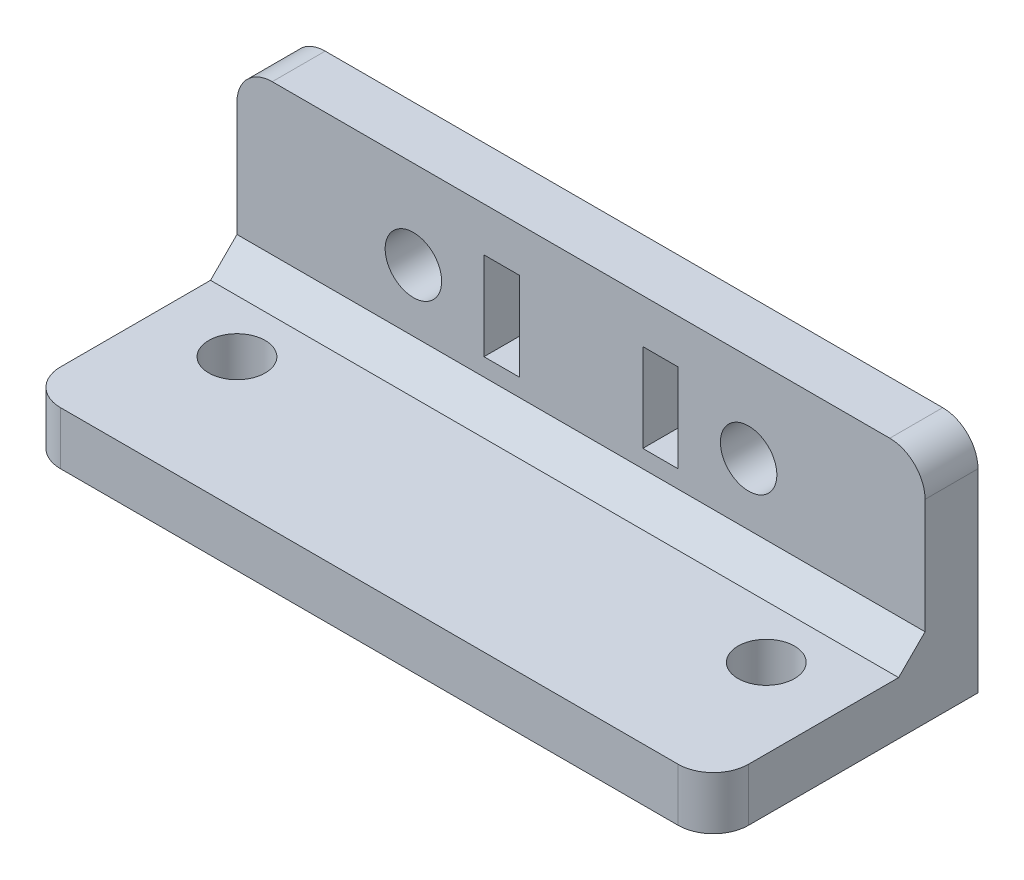
from build123d import *

# Parameters (mm, degrees)
SKETCH_1_W      = 39
SKETCH_1_H      = 10
SKETCH_1_R      = 1.6
SKETCH_1_W_2    = 2
SKETCH_1_H_2    = 5
EXTRUDE_1_DEPTH = 3
SKETCH_2_W      = 39
SKETCH_2_H      = 15
SKETCH_2_R      = 1.6
EXTRUDE_2_DEPTH = 3
CHAMFER_1_SIZE  = 1.5
FILLET_1_R      = 2


with BuildPart() as part:
    # ｽｹｯﾁ1 → ﾎﾞｽ - 押し出し1 (new body)
    with BuildSketch(Plane.XY):
        with Locations((9.5, 0)):
            Rectangle(SKETCH_1_W, SKETCH_1_H)
        Circle(SKETCH_1_R, mode=Mode.SUBTRACT)
        with Locations((19, 0)):
            Circle(SKETCH_1_R, mode=Mode.SUBTRACT)
        with Locations((5, 0)):
            Rectangle(SKETCH_1_W_2, SKETCH_1_H_2, mode=Mode.SUBTRACT)
        with Locations((14, 0)):
            Rectangle(SKETCH_1_W_2, SKETCH_1_H_2, mode=Mode.SUBTRACT)
    extrude(amount=EXTRUDE_1_DEPTH)

    # ｽｹｯﾁ2 → ﾎﾞｽ - 押し出し2 (add)
    with BuildSketch(Plane.XZ.offset(5)):
        with Locations((9.5, 7.5)):
            Rectangle(SKETCH_2_W, SKETCH_2_H)
        with Locations((-5.5, 7.5)):
            Circle(SKETCH_2_R, mode=Mode.SUBTRACT)
        with Locations((24.5, 7.5)):
            Circle(SKETCH_2_R, mode=Mode.SUBTRACT)
    extrude(amount=EXTRUDE_2_DEPTH)

    # 面取り1
    chamfer_1_edges = [part.edges().sort_by_distance(p)[0] for p in [
        (9.5, -5, 3),
    ]]
    chamfer(chamfer_1_edges, length=CHAMFER_1_SIZE)

    # ﾌｨﾚｯﾄ1
    fillet_1_edges = [part.edges().sort_by_distance(p)[0] for p in [
        (29, -6.5, 15),
        (-10, -6.5, 15),
        (29, 5, 1.5),
        (-10, 5, 1.5),
    ]]
    fillet(fillet_1_edges, radius=FILLET_1_R)


solid = part.part
